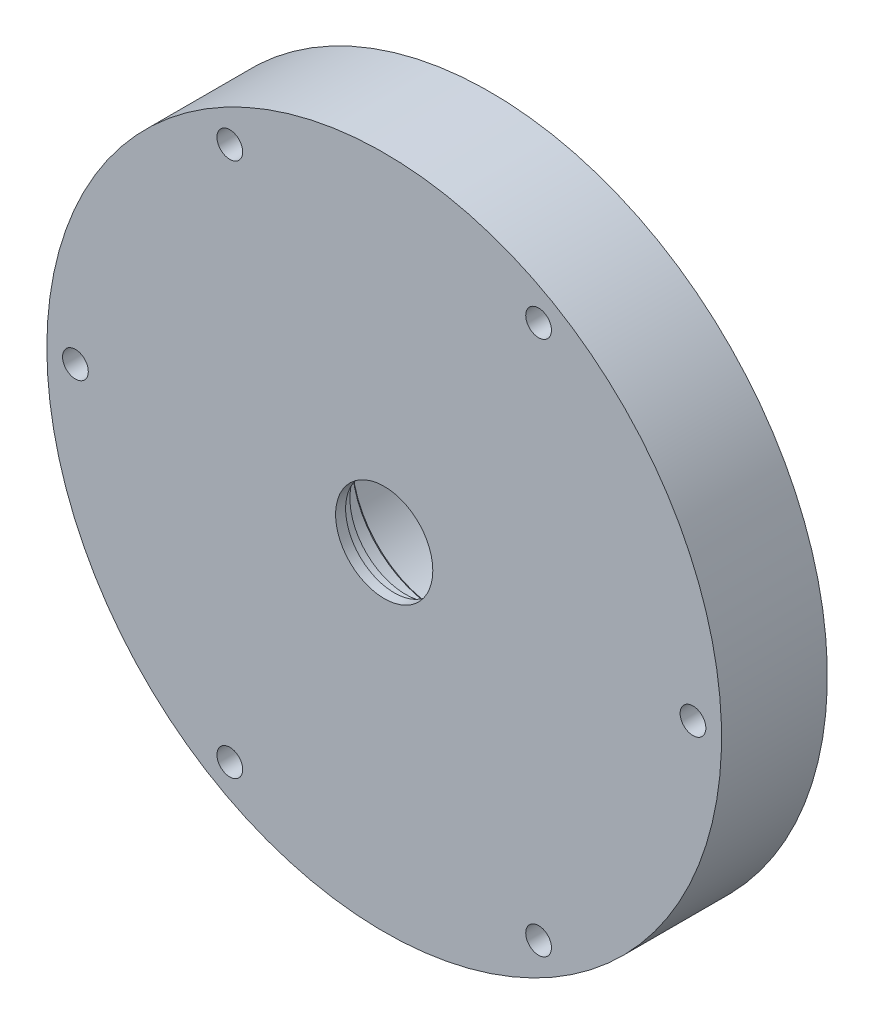
from build123d import *

# Parameters (mm, degrees)
HOLE_WIZARD_1_D = 9
CHAMFER_1_SIZE  = 1


with BuildPart() as part:
    # 草图1 → 旋转1 (revolve)
    with BuildSketch(Plane(origin=(0, 0, 0), x_dir=(0, 0, -1), z_dir=(1, 0, 0)), mode=Mode.PRIVATE) as revolve_1_sk:
        Polygon((0, 0), (0, 118), (37, 118), (37, 95), (45, 95), (45, 99), (48, 99), (48, 0), align=None)
    revolve(revolve_1_sk.sketch.rotate(Axis((0, 0, -48), (0, 0, 1)), 90), axis=Axis((0, 0, -48), (0, 0, 1)))

    # 草图2 → 切除-旋转1 (revolve, cut)
    with BuildSketch(Plane(origin=(0, 0, 0), x_dir=(0, 0, -1), z_dir=(1, 0, 0)), mode=Mode.PRIVATE) as cut_revolve_1_sk:
        Polygon((48, 0), (48, 91), (11, 91), (11, 56), (12.5, 56), (12.5, 45), (38.75, 45), (38.75, 0), align=None)
    revolve(cut_revolve_1_sk.sketch.rotate(Axis((0, 0, 0), (0, 0, -1)), 90), axis=Axis((0, 0, 0), (0, 0, -1)), mode=Mode.SUBTRACT)

    # 草图3 → 切除-旋转2 (revolve, cut)
    with BuildSketch(Plane(origin=(0, 0, 0), x_dir=(0, 0, -1), z_dir=(1, 0, 0)), mode=Mode.PRIVATE) as cut_revolve_2_sk:
        Polygon((0, 0), (0, 17), (3.5, 17), (3.5, 19.5), (7.5, 19.5), (7.5, 30), (19.75, 30), (19.75, 36), (38.75, 36), (38.75, 0), align=None)
    revolve(cut_revolve_2_sk.sketch.rotate(Axis((0, 0, 0), (0, 0, -1)), 90), axis=Axis((0, 0, 0), (0, 0, -1)), mode=Mode.SUBTRACT)

    # 孔1 (through all)
    with Locations(Plane(origin=(0, 0, -37), x_dir=(-1, 0, 0), z_dir=(0, 0, -1))):
        with Locations((54, 93.530743609), (108, 0), (54, -93.530743609), (-54, -93.530743609), (-108, 0), (-54, 93.530743609)):
            Hole(HOLE_WIZARD_1_D / 2)

    # 倒角1
    chamfer_1_edges = [part.edges().sort_by_distance(p)[0] for p in [
        (-30, 0, -19.75),
        (-36, 0, -38.75),
    ]]
    chamfer(chamfer_1_edges, length=CHAMFER_1_SIZE)


solid = part.part
